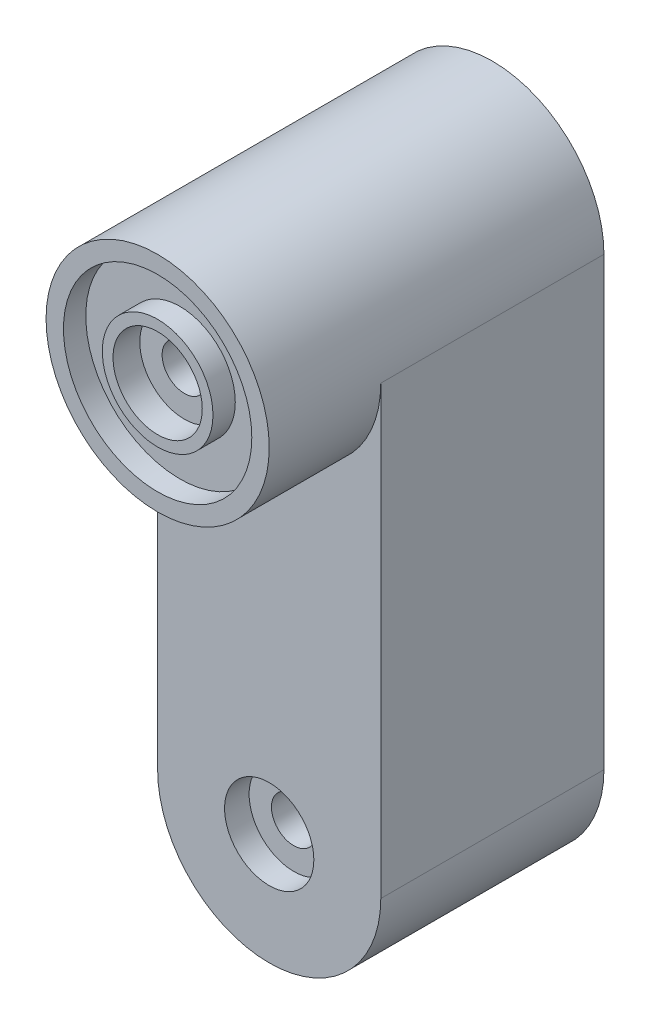
from build123d import *

# Parameters (mm, degrees)
SKIZZE4_W                       = 50
SKIZZE4_H                       = 50
AUFSATZ_LINEAR_AUSTRAGEN1_DEPTH = 150
SKIZZE5_W                       = 50
SKIZZE5_H                       = 50
AUFSATZ_LINEAR_AUSTRAGEN2_DEPTH = 25
SKIZZE6_R                       = 5
SCHNITT_LINEAR_AUSTRAGEN1_DEPTH = 75
SKIZZE8_R                       = 5
SCHNITT_LINEAR_AUSTRAGEN2_DEPTH = 50
SCHNITT_LINEAR_AUSTRAGEN3_DEPTH = 75
SCHNITT_LINEAR_AUSTRAGEN4_DEPTH = 25
SKIZZE11_R                      = 21.1
SKIZZE11_R_2                    = 12.4
SCHNITT_LINEAR_AUSTRAGEN5_DEPTH = 5
SKIZZE12_R                      = 10.2
SKIZZE12_R_2                    = 10
SCHNITT_LINEAR_AUSTRAGEN6_DEPTH = 5.5
SKIZZE13_R                      = 10
SCHNITT_LINEAR_AUSTRAGEN7_DEPTH = 6
SCHNITT_LINEAR_START            = -5.5
SKIZZE14_R                      = 10
SCHNITT_LINEAR_AUSTRAGEN8_DEPTH = 5.5


with BuildPart() as part:
    # Skizze4 → Aufsatz-Linear austragen1 (new body)
    with BuildSketch(Plane(origin=(0, 0, 0), x_dir=(1, 0, 0), z_dir=(0, 1, 0))):
        Rectangle(SKIZZE4_W, SKIZZE4_H)
    extrude(amount=AUFSATZ_LINEAR_AUSTRAGEN1_DEPTH)

    # Skizze5 → Aufsatz-Linear austragen2 (add)
    with BuildSketch(Plane.XY.offset(25)):
        with Locations((0, 125)):
            Rectangle(SKIZZE5_W, SKIZZE5_H)
    extrude(amount=AUFSATZ_LINEAR_AUSTRAGEN2_DEPTH)

    # Skizze6 → Schnitt-Linear austragen1 (cut)
    with BuildSketch(Plane.XY.offset(50)):
        with Locations((0, 125)):
            Circle(SKIZZE6_R)
    extrude(amount=-SCHNITT_LINEAR_AUSTRAGEN1_DEPTH, mode=Mode.SUBTRACT)

    # Skizze8 → Schnitt-Linear austragen2 (cut)
    with BuildSketch(Plane.XY.offset(25)):
        with BuildLine():
            ThreePointArc((0, 0), (-17.67766953, 7.32233047), (-25, 25))
            Line((-25, 25), (-25, 0))
            Line((-25, 0), (0, 0))
        make_face()
        with BuildLine():
            ThreePointArc((25, 25), (17.67766953, 7.32233047), (0, 0))
            Line((0, 0), (25, 0))
            Line((25, 0), (25, 25))
        make_face()
        with Locations((0, 25)):
            Circle(SKIZZE8_R)
    extrude(amount=-SCHNITT_LINEAR_AUSTRAGEN2_DEPTH, mode=Mode.SUBTRACT)

    # Skizze9 → Schnitt-Linear austragen3 (cut)
    with BuildSketch(Plane.XY.offset(50)):
        with BuildLine():
            Line((0, 150), (-25, 150))
            Line((-25, 150), (-25, 125))
            ThreePointArc((-25, 125), (-17.67766953, 142.67766953), (0, 150))
        make_face()
        with BuildLine():
            Line((25, 150), (0, 150))
            ThreePointArc((0, 150), (17.67766953, 142.67766953), (25, 125))
            Line((25, 125), (25, 150))
        make_face()
    extrude(amount=-SCHNITT_LINEAR_AUSTRAGEN3_DEPTH, mode=Mode.SUBTRACT)

    # Skizze10 → Schnitt-Linear austragen4 (cut)
    with BuildSketch(Plane.XY.offset(50)):
        with BuildLine():
            ThreePointArc((0, 100), (-17.67766953, 107.32233047), (-25, 125))
            Line((-25, 125), (-25, 100))
            Line((-25, 100), (0, 100))
        make_face()
        with BuildLine():
            Line((25, 100), (25, 125))
            ThreePointArc((25, 125), (17.67766953, 107.32233047), (0, 100))
            Line((0, 100), (25, 100))
        make_face()
    extrude(amount=-SCHNITT_LINEAR_AUSTRAGEN4_DEPTH, mode=Mode.SUBTRACT)

    # Skizze11 → Schnitt-Linear austragen5 (cut)
    with BuildSketch(Plane.XY.offset(50)):
        with Locations((0, 125)):
            Circle(SKIZZE11_R)
        with Locations((0, 125)):
            Circle(SKIZZE11_R_2, mode=Mode.SUBTRACT)
    extrude(amount=-SCHNITT_LINEAR_AUSTRAGEN5_DEPTH, mode=Mode.SUBTRACT)

    # Skizze12 → Schnitt-Linear austragen6 (cut)
    with BuildSketch(Plane(origin=(0, 0, -25), x_dir=(-1, 0, 0), z_dir=(0, 0, -1))):
        with Locations((0, 125)):
            Circle(SKIZZE12_R)
        with Locations((0, 25)):
            Circle(SKIZZE12_R_2)
    extrude(amount=-SCHNITT_LINEAR_AUSTRAGEN6_DEPTH, mode=Mode.SUBTRACT)

    # Skizze13 → Schnitt-Linear austragen7 (cut)
    with BuildSketch(Plane.XY.offset(50)):
        with Locations((0, 125)):
            Circle(SKIZZE13_R)
    extrude(amount=-SCHNITT_LINEAR_AUSTRAGEN7_DEPTH, mode=Mode.SUBTRACT)

    # Skizze14 → Schnitt-Linear austragen8 (cut)
    with BuildSketch(Plane.XY.offset(25).offset(SCHNITT_LINEAR_START)):
        with Locations(Location((0, 25, 0), (0, 0, 180))):
            Circle(SKIZZE14_R)
    extrude(amount=SCHNITT_LINEAR_AUSTRAGEN8_DEPTH, mode=Mode.SUBTRACT)


solid = part.part
